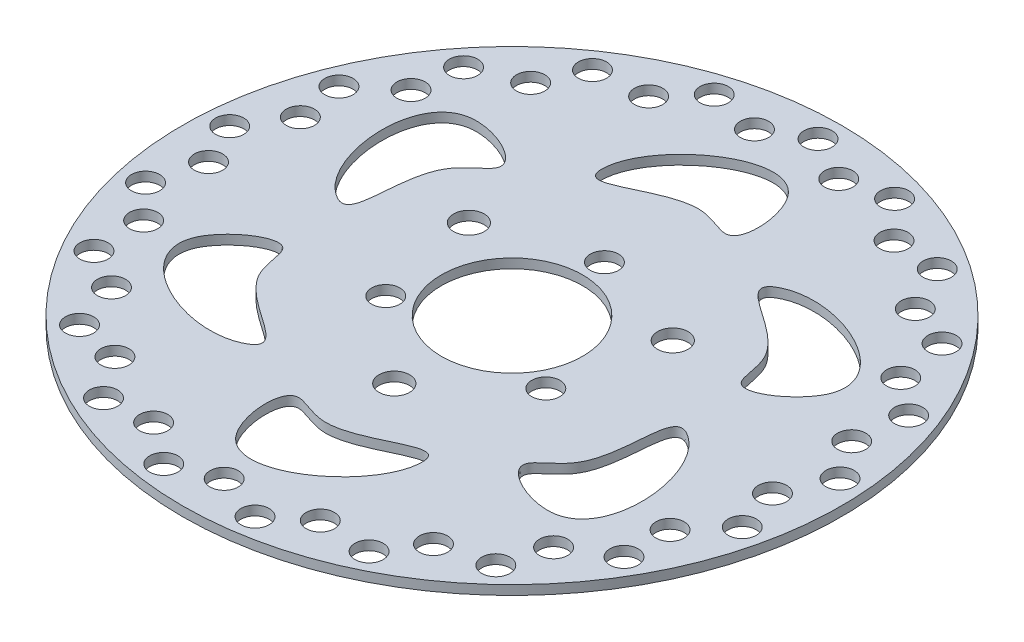
from build123d import *

# Parameters (mm, degrees)
SKETCH1_R   = 70
SKETCH1_R_2 = 3
SKETCH1_R_3 = 15
SKETCH1_R_4 = 3.25
BODY_DEPTH  = 2
HOLES_DEPTH = 100.015150356


with BuildPart() as part:
    # Sketch1 → Body (new body)
    with BuildSketch(Plane(origin=(0, 0, 0), x_dir=(1, 0, 0), z_dir=(0, 1, 0))):
        with Locations(Location((0, 0, 0), (0, 0, 270))):
            Circle(SKETCH1_R)
        with Locations(Location((0, 65, 0), (0, 0, 270))):
            Circle(SKETCH1_R_2, mode=Mode.SUBTRACT)
        with Locations(Location((19.159086337, 62.112232376, 0), (0, 0, 270))):
            Circle(SKETCH1_R_2, mode=Mode.SUBTRACT)
        with Locations(Location((36.615803774, 53.705520331, 0), (0, 0, 270))):
            Circle(SKETCH1_R_2, mode=Mode.SUBTRACT)
        with Locations(Location((50.81904636, 40.526837121, 0), (0, 0, 270))):
            Circle(SKETCH1_R_2, mode=Mode.SUBTRACT)
        with Locations(Location((60.506793662, 23.747166584, 0), (0, 0, 270))):
            Circle(SKETCH1_R_2, mode=Mode.SUBTRACT)
        with Locations(Location((64.818246817, 4.857456083, 0), (0, 0, 270))):
            Circle(SKETCH1_R_2, mode=Mode.SUBTRACT)
        with Locations(Location((63.370314292, -14.463860707, 0), (0, 0, 270))):
            Circle(SKETCH1_R_2, mode=Mode.SUBTRACT)
        with Locations(Location((56.291651246, -32.5, 0), (0, 0, 270))):
            Circle(SKETCH1_R_2, mode=Mode.SUBTRACT)
        with Locations(Location((44.211227955, -47.648371669, 0), (0, 0, 270))):
            Circle(SKETCH1_R_2, mode=Mode.SUBTRACT)
        with Locations(Location((28.202443043, -58.562976414, 0), (0, 0, 270))):
            Circle(SKETCH1_R_2, mode=Mode.SUBTRACT)
        with Locations(Location((9.687747301, -64.274003705, 0), (0, 0, 270))):
            Circle(SKETCH1_R_2, mode=Mode.SUBTRACT)
        with Locations(Location((-9.687747301, -64.274003705, 0), (0, 0, 270))):
            Circle(SKETCH1_R_2, mode=Mode.SUBTRACT)
        with Locations(Location((-28.202443043, -58.562976414, 0), (0, 0, 270))):
            Circle(SKETCH1_R_2, mode=Mode.SUBTRACT)
        with Locations(Location((-44.211227955, -47.648371669, 0), (0, 0, 270))):
            Circle(SKETCH1_R_2, mode=Mode.SUBTRACT)
        with Locations(Location((-56.291651246, -32.5, 0), (0, 0, 270))):
            Circle(SKETCH1_R_2, mode=Mode.SUBTRACT)
        with Locations(Location((-8.5, 60, 0), (0, 0, 270))):
            Circle(SKETCH1_R_2, mode=Mode.SUBTRACT)
        with Locations(Location((9.562941615, 59.83978733, 0), (0, 0, 270))):
            Circle(SKETCH1_R_2, mode=Mode.SUBTRACT)
        with Locations(Location((26.776173902, 54.362546953, 0), (0, 0, 270))):
            Circle(SKETCH1_R_2, mode=Mode.SUBTRACT)
        with Locations(Location((41.610225632, 44.054955713, 0), (0, 0, 270))):
            Circle(SKETCH1_R_2, mode=Mode.SUBTRACT)
        with Locations(Location((52.747026212, 29.832888325, 0), (0, 0, 270))):
            Circle(SKETCH1_R_2, mode=Mode.SUBTRACT)
        with Locations(Location((59.197022035, 12.960037891, 0), (0, 0, 270))):
            Circle(SKETCH1_R_2, mode=Mode.SUBTRACT)
        with Locations(Location((60.38710267, -5.064368784, 0), (0, 0, 270))):
            Circle(SKETCH1_R_2, mode=Mode.SUBTRACT)
        with Locations(Location((56.211524227, -22.638784068, 0), (0, 0, 270))):
            Circle(SKETCH1_R_2, mode=Mode.SUBTRACT)
        with Locations(Location((47.041305177, -38.201644039, 0), (0, 0, 270))):
            Circle(SKETCH1_R_2, mode=Mode.SUBTRACT)
        with Locations(Location((33.691259724, -50.370120292, 0), (0, 0, 270))):
            Circle(SKETCH1_R_2, mode=Mode.SUBTRACT)
        with Locations(Location((17.347597993, -58.062990311, 0), (0, 0, 270))):
            Circle(SKETCH1_R_2, mode=Mode.SUBTRACT)
        with Locations(Location((-0.537473948, -60.596708836, 0), (0, 0, 270))):
            Circle(SKETCH1_R_2, mode=Mode.SUBTRACT)
        with Locations(Location((-18.37478897, -57.746143857, 0), (0, 0, 270))):
            Circle(SKETCH1_R_2, mode=Mode.SUBTRACT)
        with Locations(Location((-34.579423356, -49.764580581, 0), (0, 0, 270))):
            Circle(SKETCH1_R_2, mode=Mode.SUBTRACT)
        with Locations(Location((-47.711524227, -37.361215932, 0), (0, 0, 270))):
            Circle(SKETCH1_R_2, mode=Mode.SUBTRACT)
        with Locations(Location((0, 0, 0), (0, 0, 270))):
            Circle(SKETCH1_R_3, mode=Mode.SUBTRACT)
        with Locations(Location((0, 19.629909152, 0), (0, 0, 270))):
            Circle(SKETCH1_R_2, mode=Mode.SUBTRACT)
        with Locations(Location((17, -9.814954576, 0), (0, 0, 270))):
            Circle(SKETCH1_R_2, mode=Mode.SUBTRACT)
        with Locations(Location((-17, -9.814954576, 0), (0, 0, 270))):
            Circle(SKETCH1_R_2, mode=Mode.SUBTRACT)
        with Locations(Location((-63.370314292, -14.463860707, 0), (0, 0, 270))):
            Circle(SKETCH1_R_2, mode=Mode.SUBTRACT)
        with Locations(Location((-64.818246817, 4.857456083, 0), (0, 0, 270))):
            Circle(SKETCH1_R_2, mode=Mode.SUBTRACT)
        with Locations(Location((-60.506793662, 23.747166584, 0), (0, 0, 270))):
            Circle(SKETCH1_R_2, mode=Mode.SUBTRACT)
        with Locations(Location((-50.81904636, 40.526837121, 0), (0, 0, 270))):
            Circle(SKETCH1_R_2, mode=Mode.SUBTRACT)
        with Locations(Location((-36.615803774, 53.705520331, 0), (0, 0, 270))):
            Circle(SKETCH1_R_2, mode=Mode.SUBTRACT)
        with Locations(Location((-19.159086337, 62.112232376, 0), (0, 0, 270))):
            Circle(SKETCH1_R_2, mode=Mode.SUBTRACT)
        with Locations(Location((-56.604246792, -21.638143291, 0), (0, 0, 270))):
            Circle(SKETCH1_R_2, mode=Mode.SUBTRACT)
        with Locations(Location((-60.467433626, -3.992426661, 0), (0, 0, 270))):
            Circle(SKETCH1_R_2, mode=Mode.SUBTRACT)
        with Locations(Location((-58.957823626, 14.008034599, 0), (0, 0, 270))):
            Circle(SKETCH1_R_2, mode=Mode.SUBTRACT)
        with Locations(Location((-52.209552264, 30.763820511, 0), (0, 0, 270))):
            Circle(SKETCH1_R_2, mode=Mode.SUBTRACT)
        with Locations(Location((-40.822233066, 44.786105965, 0), (0, 0, 270))):
            Circle(SKETCH1_R_2, mode=Mode.SUBTRACT)
        with Locations(Location((-25.807679314, 54.828949365, 0), (0, 0, 270))):
            Circle(SKETCH1_R_2, mode=Mode.SUBTRACT)
        with Locations(Location((21.650635095, 12.5, 0), (0, 0, 270))):
            Circle(SKETCH1_R_4, mode=Mode.SUBTRACT)
        with Locations(Location((0, -25, 0), (0, 0, 270))):
            Circle(SKETCH1_R_4, mode=Mode.SUBTRACT)
        with Locations(Location((-21.650635095, 12.5, 0), (0, 0, 270))):
            Circle(SKETCH1_R_4, mode=Mode.SUBTRACT)
    extrude(amount=BODY_DEPTH)

    # Sketch3 → Holes (cut, through all)
    with BuildSketch(Plane(origin=(0, 2, 0), x_dir=(1, 0, 0), z_dir=(0, 1, 0))):
        with BuildLine():
            add(Edge.make_bspline(
                [(36.840085109, 11.847819133), (39.088921127, 9.828661928), (61.198790866, 25.029895617), (31.891186133, 38.403591416), (16.994752564, 30.017348819), (36.567886537, 24.314306348), (35.577713203, 12.981262083), (36.840085109, 11.847819133)],
                knots=[0, 0, 0, 0, 0.195832342, 0.603309641, 0.625258895, 0.890070577, 1, 1, 1, 1], degree=3))
        make_face()
        with BuildLine():
            add(Edge.make_bspline(
                [(28.680554903, -25.980540015), (28.056331479, -28.937667739), (52.275920891, -40.484759762), (49.204078829, -8.41678164), (34.493162913, 0.290786958), (39.340750241, -19.511565529), (29.030959338, -24.320572401), (28.680554903, -25.980540015)],
                knots=[0, 0, 0, 0, 0.195832342, 0.603309641, 0.625258895, 0.890070577, 1, 1, 1, 1], degree=3))
        make_face()
        with BuildLine():
            add(Edge.make_bspline(
                [(-8.159530205, -37.828359148), (-11.032589649, -38.766329667), (-8.922869974, -65.514655379), (17.312892696, -46.820373055), (17.498410349, -29.726561861), (2.772863705, -43.825871878), (-6.546753865, -37.301834483), (-8.159530205, -37.828359148)],
                knots=[0, 0, 0, 0, 0.195832342, 0.603309641, 0.625258895, 0.890070577, 1, 1, 1, 1], degree=3))
        make_face()
        with BuildLine():
            add(Edge.make_bspline(
                [(8.159530205, 37.828359148), (11.032589649, 38.766329667), (8.922869974, 65.514655379), (-17.312892696, 46.820373055), (-17.498410349, 29.726561861), (-2.772863705, 43.825871878), (6.546753865, 37.301834483), (8.159530205, 37.828359148)],
                knots=[0, 0, 0, 0, 0.195832342, 0.603309641, 0.625258895, 0.890070577, 1, 1, 1, 1], degree=3))
        make_face()
        with BuildLine():
            add(Edge.make_bspline(
                [(-36.840085109, -11.847819133), (-39.088921127, -9.828661928), (-61.198790866, -25.029895617), (-31.891186133, -38.403591416), (-16.994752564, -30.017348819), (-36.567886537, -24.314306348), (-35.577713203, -12.981262083), (-36.840085109, -11.847819133)],
                knots=[0, 0, 0, 0, 0.195832342, 0.603309641, 0.625258895, 0.890070577, 1, 1, 1, 1], degree=3))
        make_face()
        with BuildLine():
            add(Edge.make_bspline(
                [(-28.680554903, 25.980540015), (-28.056331479, 28.937667739), (-52.275920891, 40.484759762), (-49.204078829, 8.41678164), (-34.493162913, -0.290786958), (-39.340750241, 19.511565529), (-29.030959338, 24.320572401), (-28.680554903, 25.980540015)],
                knots=[0, 0, 0, 0, 0.195832342, 0.603309641, 0.625258895, 0.890070577, 1, 1, 1, 1], degree=3))
        make_face()
    extrude(amount=-HOLES_DEPTH, mode=Mode.SUBTRACT)


solid = part.part
